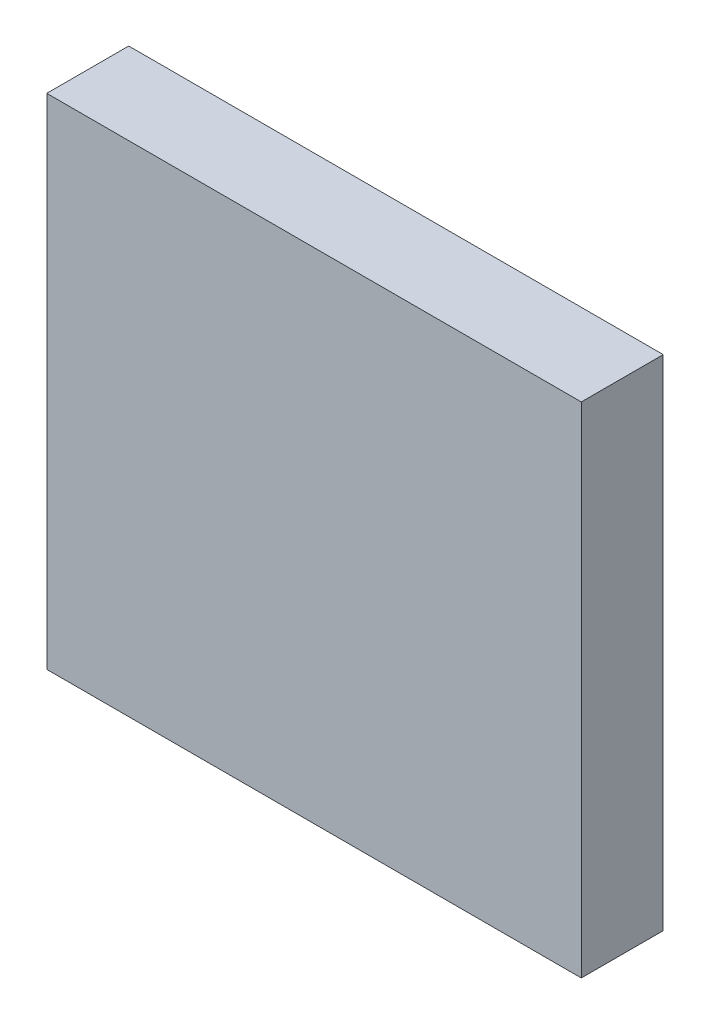
from build123d import *

# Parameters (mm, degrees)
SKETCH1_W           = 19.05
SKETCH1_H           = 17.78
BOSS_EXTRUDE1_DEPTH = 2.921


with BuildPart() as part:
    # Sketch1 → Boss-Extrude1 (new body)
    with BuildSketch(Plane.XY):
        Rectangle(SKETCH1_W, SKETCH1_H)
    extrude(amount=BOSS_EXTRUDE1_DEPTH)


solid = part.part
